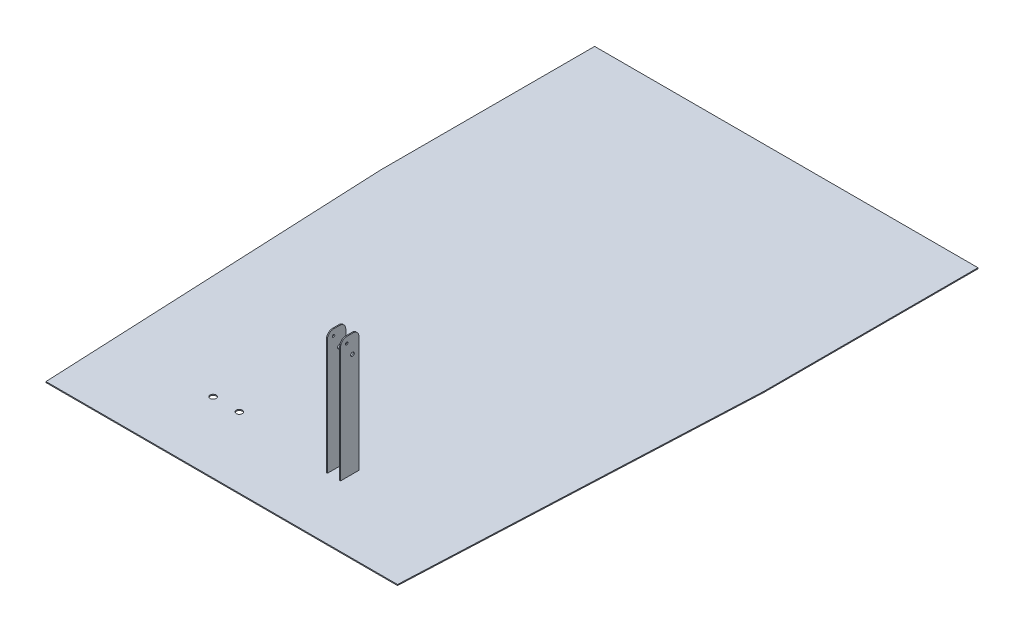
from build123d import *

# Parameters (mm, degrees)
BOSS_EXTRUDE1_DEPTH = 1.6
SKETCH2_R           = 5
CUT_EXTRUDE1_DEPTH  = 1.6
SKETCH3_W           = 1.6
SKETCH3_H           = 30
BOSS_EXTRUDE2_DEPTH = 200
SKETCH4_R           = 2
SKETCH4_R_2         = 3
CUT_EXTRUDE2_DEPTH  = 1032.168031188
FILLET1_R           = 10


with BuildPart() as part:
    # Sketch1 → Boss-Extrude1 (new body)
    with BuildSketch(Plane(origin=(0, 0, 0), x_dir=(1, 0, 0), z_dir=(0, 1, 0))):
        Polygon((0, 0), (576, 0), (602.078810398, 574.3), (602.078810398, 925.1), (-26.078810398, 925.1), (-26.078810398, 574.3), align=None)
    extrude(amount=BOSS_EXTRUDE1_DEPTH)

    # Sketch2 → Cut-Extrude1 (cut)
    with BuildSketch(Plane(origin=(0, 1.6, 0), x_dir=(1, 0, 0), z_dir=(0, 1, 0))):
        with Locations(Location((201.5, 115.4, 0), (0, 0, 270))):
            Circle(SKETCH2_R)
        with Locations(Location((158.5, 115.4, 0), (0, 0, 270))):
            Circle(SKETCH2_R)
    extrude(amount=-CUT_EXTRUDE1_DEPTH, mode=Mode.SUBTRACT)

    # Sketch3 → Boss-Extrude2 (add)
    with BuildSketch(Plane(origin=(0, 1.6, 0), x_dir=(1, 0, 0), z_dir=(0, 1, 0))):
        with Locations((360, 115.4)):
            Rectangle(SKETCH3_W, SKETCH3_H)
        with Locations((381.6, 115.4)):
            Rectangle(SKETCH3_W, SKETCH3_H)
    extrude(amount=BOSS_EXTRUDE2_DEPTH)

    # Sketch4 → Cut-Extrude2 (cut, through all)
    with BuildSketch(Plane(origin=(382.4, 0, 0), x_dir=(0, 0, -1), z_dir=(1, 0, 0))):
        with Locations((110.4, 191.6)):
            Circle(SKETCH4_R)
        with Locations((119.726153163, 171.6)):
            Circle(SKETCH4_R_2)
    extrude(amount=-CUT_EXTRUDE2_DEPTH, mode=Mode.SUBTRACT)

    # Fillet1
    fillet1_edges = [part.edges().sort_by_distance(p)[0] for p in [
        (360, 201.6, -130.4),
        (360, 201.6, -100.4),
        (381.6, 201.6, -130.4),
        (381.6, 201.6, -100.4),
    ]]
    fillet(fillet1_edges, radius=FILLET1_R)


solid = part.part
